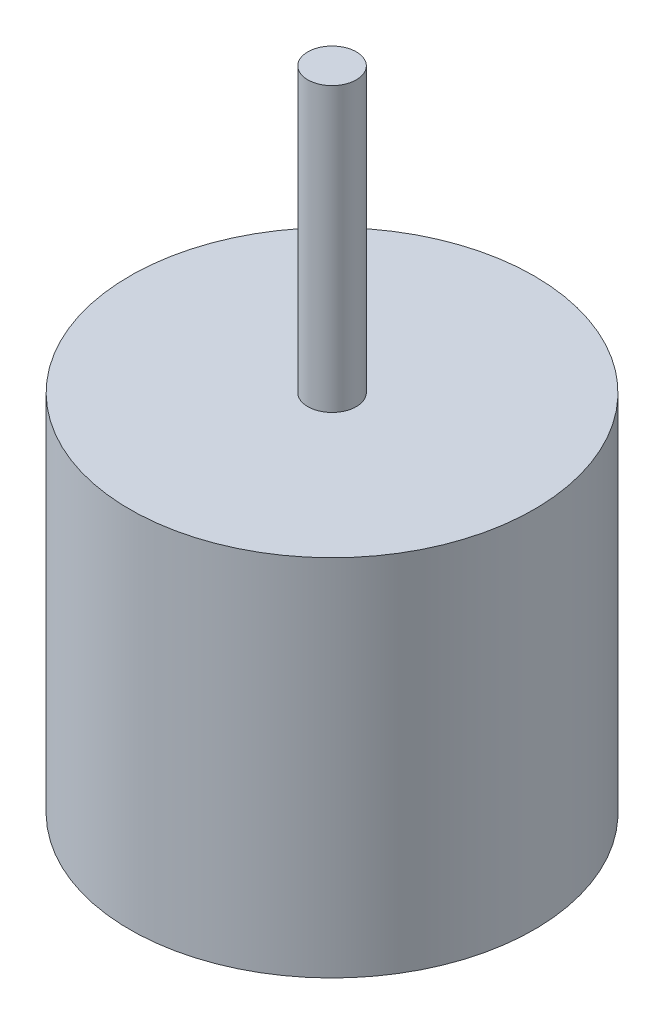
from build123d import *

# Parameters (mm, degrees)
SKETCH1_R           = 25
BOSS_EXTRUDE1_DEPTH = 45
SKETCH2_R           = 3
BOSS_EXTRUDE2_DEPTH = 35


with BuildPart() as part:
    # Sketch1 → Boss-Extrude1 (new body)
    with BuildSketch(Plane(origin=(0, 0, 0), x_dir=(1, 0, 0), z_dir=(0, 1, 0))):
        with Locations(Location((0, 0, 0), (0, 0, 90))):
            Circle(SKETCH1_R)
    extrude(amount=BOSS_EXTRUDE1_DEPTH)

    # Sketch2 → Boss-Extrude2 (add)
    with BuildSketch(Plane(origin=(0, 45, 0), x_dir=(1, 0, 0), z_dir=(0, 1, 0))):
        with Locations(Location((0, 0, 0), (0, 0, 270))):
            Circle(SKETCH2_R)
    extrude(amount=BOSS_EXTRUDE2_DEPTH)


solid = part.part
